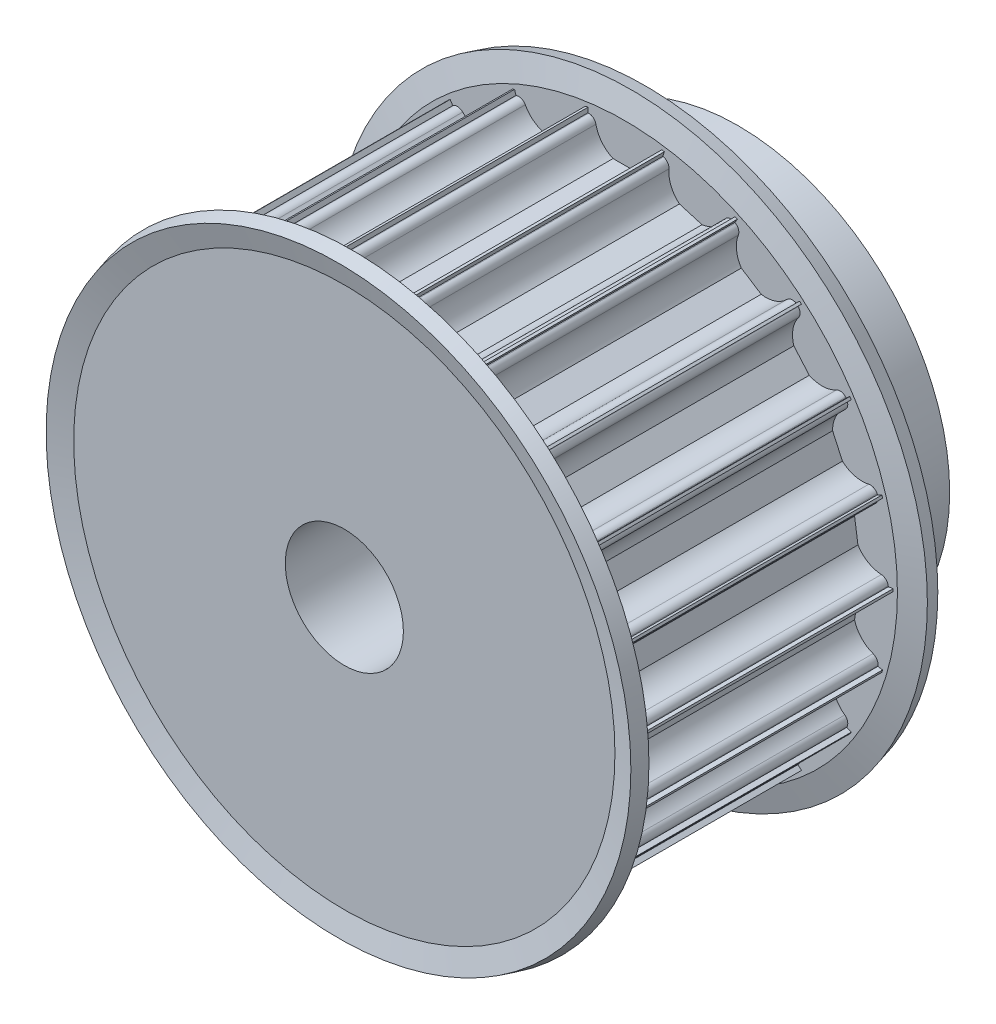
from build123d import *

# Parameters (mm, degrees)
CUT_EXTRUDE1_DEPTH = 56.543901555
CIRPATTERN1_COUNT  = 22


with BuildPart() as part:
    # Sketch1 → Revolve1 (revolve)
    with BuildSketch(Plane(origin=(0, 0, 0), x_dir=(0, 0, -1), z_dir=(1, 0, 0))):
        Polygon((0, 6), (0, 27.25), (30, 27.25), (30, 21.5), (40, 21.5), (40, 6), align=None)
    revolve(axis=Axis((0, 0, 101.727310717), (0, 0, -1)))

    # Sketch2 → Cut-Extrude1 (cut, through all)
    with BuildSketch(Plane.XY):
        with BuildLine():
            Line((3.674234614, 26.5), (3.75, 26.5))
            Line((3.75, 26.5), (3.75, 28.5))
            Line((3.75, 28.5), (-3.75, 28.5))
            Line((-3.75, 28.5), (-3.75, 26.5))
            Line((-3.75, 26.5), (-3.674234614, 26.5))
            ThreePointArc((-3.674234614, 26.5), (-3.199892965, 26.330947502), (-2.939387691, 25.9))
            ThreePointArc((-2.939387691, 25.9), (-2.331759211, 24.612435701), (-1.198957881, 23.75))
            Line((-1.198957881, 23.75), (1.198957881, 23.75))
            ThreePointArc((1.198957881, 23.75), (2.331759211, 24.612435701), (2.939387691, 25.9))
            ThreePointArc((2.939387691, 25.9), (3.199892965, 26.330947502), (3.674234614, 26.5))
        make_face()
    cut_extrude1 = extrude(amount=-CUT_EXTRUDE1_DEPTH, mode=Mode.SUBTRACT)

    # CirPattern1: Cut-Extrude1 ×22 about axis
    cirpattern1_axis = Axis((0, 0, 101.727310717), (0, 0, -1))
    for i in range(1, CIRPATTERN1_COUNT):
        add(cut_extrude1.rotate(cirpattern1_axis, i * 360 / CIRPATTERN1_COUNT), mode=Mode.SUBTRACT)

    # Sketch3 → Revolve2 (revolve)
    with BuildSketch(Plane(origin=(0, 0, 0), x_dir=(0, 0, -1), z_dir=(1, 0, 0))):
        Polygon((-0.591966801, 29.702510585), (0, 27.493260406), (0, 22.690739153), (1.5, 22.690739153), (1.5, 27.690739153), (0.856921938, 30.090739153), align=None)
    revolve(axis=Axis((0, 0, 101.727310717), (0, 0, -1)))

    # Sketch3<4> → Revolve3 (revolve)
    with BuildSketch(Plane(origin=(0, 0, 0), x_dir=(0, 0, -1), z_dir=(1, 0, 0))):
        Polygon((30.591966801, 29.702510585), (29.143078062, 30.090739153), (28.5, 27.690739153), (28.5, 22.690739153), (30, 22.690739153), (30, 27.493260406), align=None)
    revolve(axis=Axis((0, 0, 101.727310717), (0, 0, -1)))


solid = part.part
